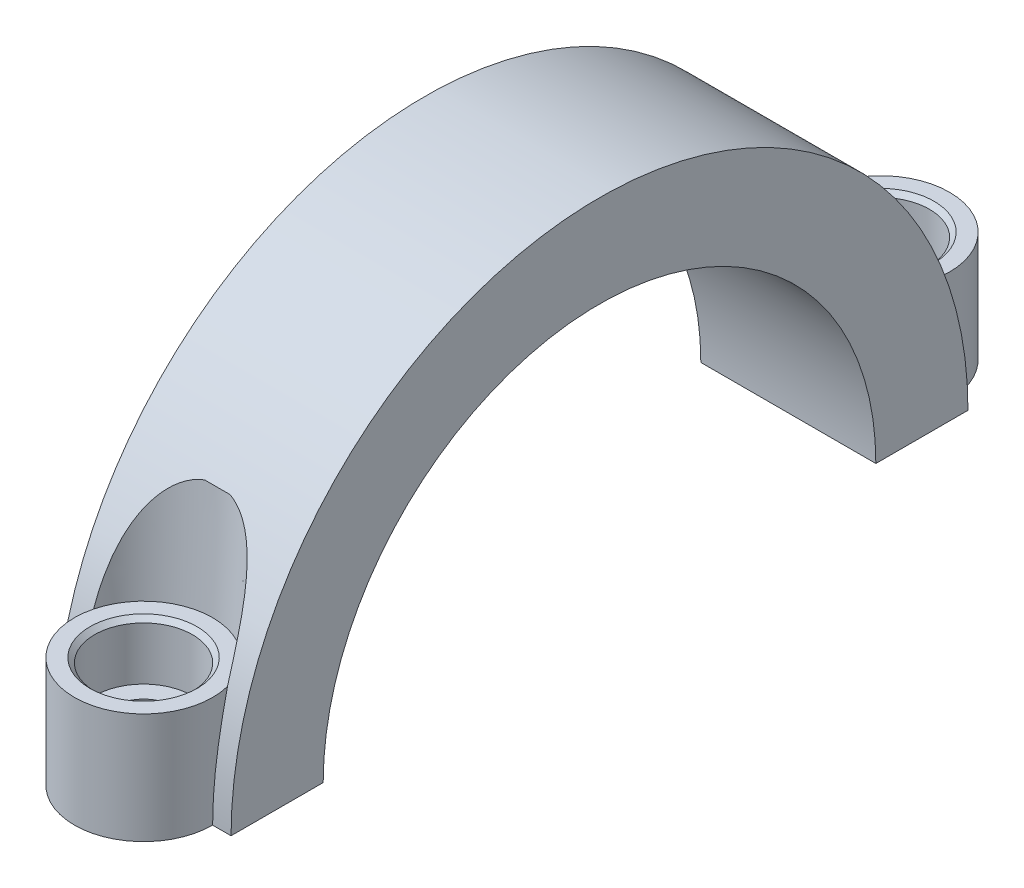
from build123d import *

# Parameters (mm, degrees)
BOSS_EXTRUDE1_DEPTH     = 12.065
SKETCH6_R               = 9.525
BOSS_EXTRUDE2_DEPTH     = 15.25
CUT_EXTRUDE2_START      = -15.25
SKETCH6_7_R             = 9.525
CUT_EXTRUDE2_DEPTH      = 15.25
CUT_EXTRUDE2_DRAFT      = 3
MIRROR2_START           = -15.25
MIRROR2_COPY_1_SKETCH_R = 9.525
MIRROR2_COPY_1_DEPTH    = 15.25
MIRROR2_COPY_1_DRAFT    = 3


with BuildPart() as part:
    # Sketch2 → Boss-Extrude1 (new, symmetric)
    with BuildSketch(Plane(origin=(0, 0, 0), x_dir=(0, 0, -1), z_dir=(1, 0, 0))):
        with BuildLine():
            Line((-50.8, 0), (-38.1, 0))
            ThreePointArc((-38.1, 0), (0, 38.1), (38.1, 0))
            Line((38.1, 0), (50.8, 0))
            ThreePointArc((50.8, 0), (0, 50.8), (-50.8, 0))
        make_face()
    extrude(amount=BOSS_EXTRUDE1_DEPTH, both=True)

    # Sketch6 → Boss-Extrude2 (add)
    with BuildSketch(Plane.XZ):
        with Locations((0, -50.8)):
            Circle(SKETCH6_R)
    boss_extrude2 = extrude(amount=-BOSS_EXTRUDE2_DEPTH)


with BuildPart() as cut_extrude2_tool:
    # Sketch6<7> → Cut-Extrude2 (with draft: the straight prism first)
    with BuildSketch(Plane.XZ.offset(CUT_EXTRUDE2_START)):
        with Locations((0, -50.8)):
            Circle(SKETCH6_7_R)
    extrude(amount=-CUT_EXTRUDE2_DEPTH)
    # Cut-Extrude2: the draft: its side faces are tilted about the plane it starts from
    cut_extrude2_sides = [cut_extrude2_tool.faces().sort_by_distance(p)[0] for p in [
        (-9.525, 22.875, -50.8),
    ]]
    draft(cut_extrude2_sides, Plane.XZ.offset(CUT_EXTRUDE2_START), CUT_EXTRUDE2_DRAFT)


with BuildPart() as part_1:
    add(part.part)

    # Cut-Extrude2: cut by cut_extrude2_tool
    add(cut_extrude2_tool.part, mode=Mode.SUBTRACT)

    # Sketch15 → CBORE for 5/16 Socket Head Cap Screw1 (revolve, cut)
    with BuildSketch(Plane(origin=(0, 15.25, -50.8), x_dir=(0, 0, 1), z_dir=(1, 0, 0))):
        Polygon((0, 0), (0, 15.25), (4.2164, 15.25), (4.2164, 7.9375), (6.74751, 7.9375), (6.74751, 0.635), (7.38251, 0), align=None)
    cbore_for_5_16_socket_head_cap_screw1 = revolve(axis=Axis((0, 21.6, -50.8), (0, -1, 0)), mode=Mode.SUBTRACT)

    # Mirror2: Boss-Extrude2, CBORE for 5/16 Socket Head Cap Screw1 across plane
    add(boss_extrude2.mirror(Plane.XY))
    add(cbore_for_5_16_socket_head_cap_screw1.mirror(Plane.XY), mode=Mode.SUBTRACT)


with BuildPart() as mirror2_copy_1_tool:
    # Mirror2 copy 1 sketch → Mirror2 copy 1 (with draft: the straight prism first)
    with BuildSketch(Plane.XZ.offset(MIRROR2_START)):
        with Locations((0, 50.8)):
            Circle(MIRROR2_COPY_1_SKETCH_R)
    extrude(amount=-MIRROR2_COPY_1_DEPTH)
    # Mirror2 copy 1: the draft: its side faces are tilted about the plane it starts from
    mirror2_copy_1_sides = [mirror2_copy_1_tool.faces().sort_by_distance(p)[0] for p in [
        (-9.525, 22.875, 50.8),
    ]]
    draft(mirror2_copy_1_sides, Plane.XZ.offset(MIRROR2_START), MIRROR2_COPY_1_DRAFT)


with BuildPart() as part_2:
    add(part_1.part)

    # Mirror2 copy 1: cut by mirror2_copy_1_tool
    add(mirror2_copy_1_tool.part, mode=Mode.SUBTRACT)


solid = part_2.part
